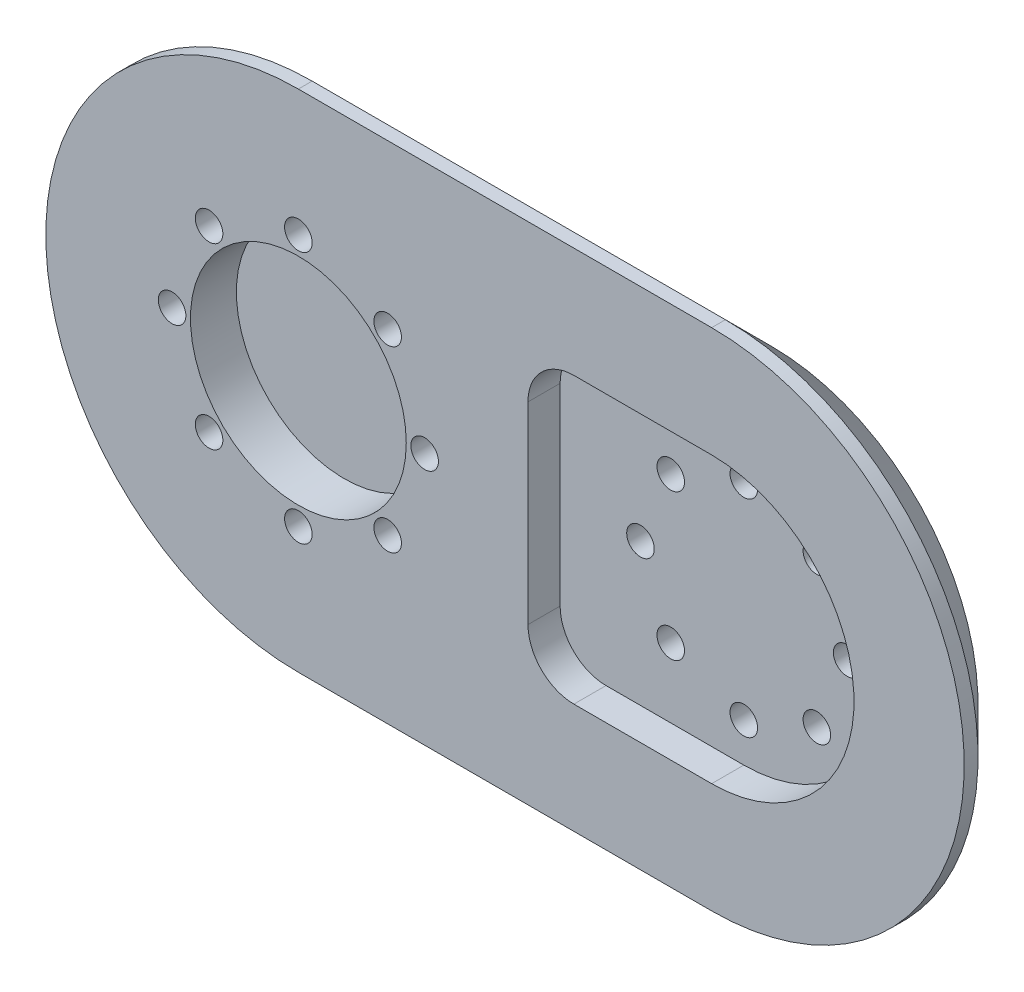
from build123d import *

# Parameters (mm, degrees)
EXTRUDE_1_DEPTH     = 13
SKETCH_2_R          = 31
CUT_EXTRUDE_3_DEPTH = 7
SKETCH_4_R          = 3
CUT_EXTRUDE_4_DEPTH = 31
CHAMFER_1_SIZE      = 10
CUT_EXTRUDE_5_DEPTH = 7
SKETCH_7_R          = 3
CUT_EXTRUDE_7_DEPTH = 80
FILLET_1_R          = 10
SKETCH_8_R          = 23.5
CUT_EXTRUDE_8_DEPTH = 10


with BuildPart() as part:
    # 草图1 → 拉伸1 (new body)
    with BuildSketch(Plane.XY):
        with BuildLine():
            Line((0, 55), (90, 55))
            ThreePointArc((90, 55), (145, 0), (90, -55))
            Line((90, -55), (0, -55))
            ThreePointArc((0, -55), (-55, 0), (0, 55))
        make_face()
    extrude(amount=EXTRUDE_1_DEPTH)

    # 草图2 → 切除-拉伸3 (cut)
    with BuildSketch(Plane.XY.offset(13)):
        with Locations((90, 0)):
            Circle(SKETCH_2_R)
    extrude(amount=-CUT_EXTRUDE_3_DEPTH, mode=Mode.SUBTRACT)

    # 草图4 → 切除-拉伸4 (cut)
    with BuildSketch(Plane(origin=(0, 0, 0), x_dir=(-1, 0, 0), z_dir=(0, 0, -1))):
        with Locations((-90, 22.5)):
            Circle(SKETCH_4_R)
        with Locations((-74.090097423, 15.909902577)):
            Circle(SKETCH_4_R)
        with Locations((-67.5, 0)):
            Circle(SKETCH_4_R)
        with Locations((-74.090097423, -15.909902577)):
            Circle(SKETCH_4_R)
        with Locations((-90, -22.5)):
            Circle(SKETCH_4_R)
        with Locations((-105.909902577, -15.909902577)):
            Circle(SKETCH_4_R)
        with Locations((-112.5, 0)):
            Circle(SKETCH_4_R)
        with Locations((-105.909902577, 15.909902577)):
            Circle(SKETCH_4_R)
    extrude(amount=-CUT_EXTRUDE_4_DEPTH, mode=Mode.SUBTRACT)

    # 倒角1
    chamfer_1_edges = [part.edges().sort_by_distance(p)[0] for p in [
        (45, 55, 0),
        (145, 0, 0),
        (45, -55, 0),
        (-55, 0, 0),
    ]]
    chamfer(chamfer_1_edges, length=CHAMFER_1_SIZE)

    # 草图5 → 切除-拉伸5 (cut)
    with BuildSketch(Plane.XY.offset(13)):
        with BuildLine():
            Line((50, 31), (90, 31))
            ThreePointArc((90, 31), (121, 0), (90, -31))
            Line((90, -31), (50, -31))
            Line((50, -31), (50, 31))
        make_face()
    extrude(amount=-CUT_EXTRUDE_5_DEPTH, mode=Mode.SUBTRACT)

    # 草图7 → 切除-拉伸7 (cut)
    with BuildSketch(Plane(origin=(0, 0, 0), x_dir=(-1, 0, 0), z_dir=(0, 0, -1))):
        with Locations((19.445436483, 19.445436483)):
            Circle(SKETCH_7_R)
        with Locations((27.5, 0)):
            Circle(SKETCH_7_R)
        with Locations((19.445436483, -19.445436483)):
            Circle(SKETCH_7_R)
        with Locations((0, -27.5)):
            Circle(SKETCH_7_R)
        with Locations((0, 27.5)):
            Circle(SKETCH_7_R)
        with Locations((-19.445436483, -19.445436483)):
            Circle(SKETCH_7_R)
        with Locations((-27.5, 0)):
            Circle(SKETCH_7_R)
        with Locations((-19.445436483, 19.445436483)):
            Circle(SKETCH_7_R)
    extrude(amount=-CUT_EXTRUDE_7_DEPTH, mode=Mode.SUBTRACT)

    # 圆角1
    fillet_1_edges = [part.edges().sort_by_distance(p)[0] for p in [
        (50, -31, 9.5),
        (50, 31, 9.5),
    ]]
    fillet(fillet_1_edges, radius=FILLET_1_R)

    # 草图8 → 切除-拉伸8 (cut)
    with BuildSketch(Plane.XY.offset(13)):
        Circle(SKETCH_8_R)
    extrude(amount=-CUT_EXTRUDE_8_DEPTH, mode=Mode.SUBTRACT)


solid = part.part
